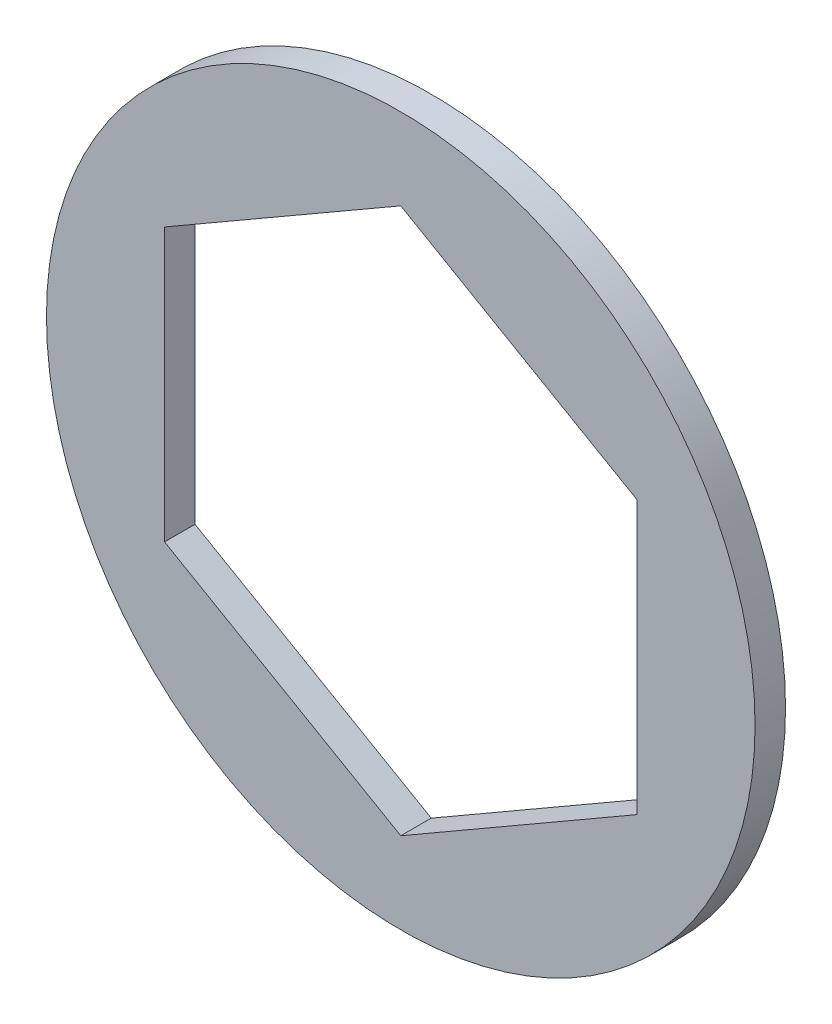
from build123d import *

# Parameters (mm, degrees)
SKETCH1_R           = 9.525
BOSS_EXTRUDE1_DEPTH = 0.409575


with BuildPart() as part:
    # Sketch1 → Boss-Extrude1 (new, symmetric)
    with BuildSketch(Plane.XY):
        with Locations(Location((0, 0, 0), (0, 0, 180))):
            Circle(SKETCH1_R)
        Polygon((0, 7.332348419), (-6.35, 3.666174209), (-6.35, -3.666174209), (0, -7.332348419), (6.35, -3.666174209), (6.35, 3.666174209), align=None, mode=Mode.SUBTRACT)
    extrude(amount=BOSS_EXTRUDE1_DEPTH, both=True)


solid = part.part
